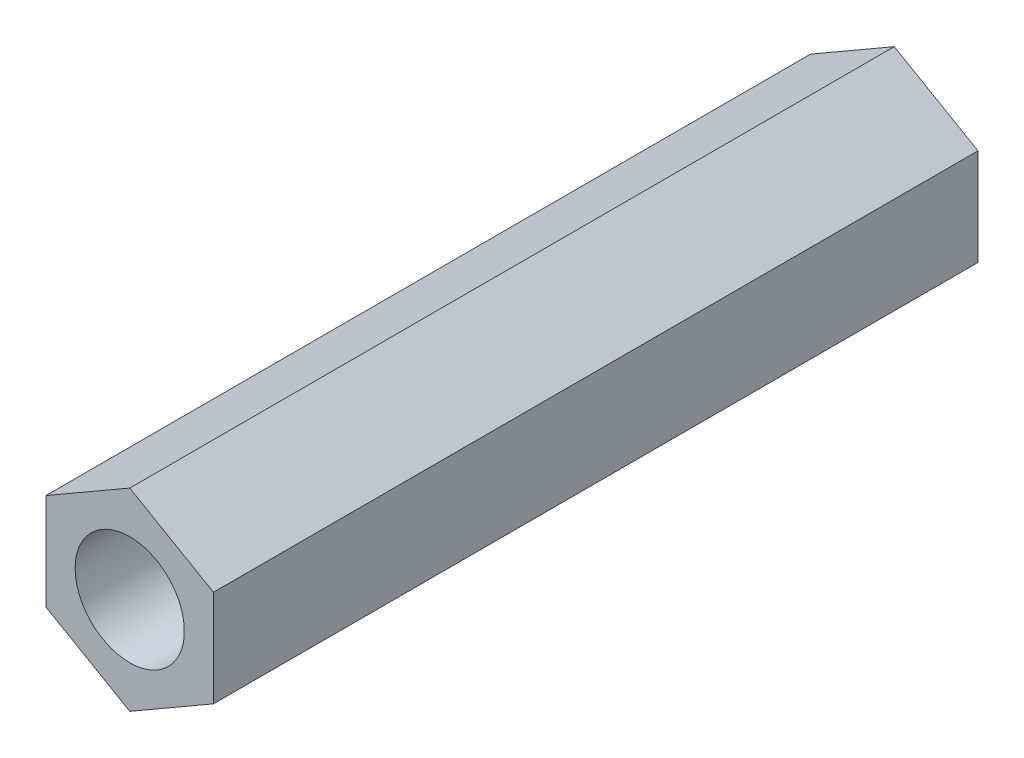
from build123d import *

# Parameters (mm, degrees)
SKETCH_1_R      = 1.5
EXTRUDE_1_DEPTH = 21


with BuildPart() as part:
    # 草图1 → 凸台-拉伸1 (new body)
    with BuildSketch(Plane.XY):
        Polygon((2.3, -1.327905619), (2.3, 1.327905619), (0, 2.655811238), (-2.3, 1.327905619), (-2.3, -1.327905619), (0, -2.655811238), align=None)
        with Locations(Location((0, 0, 0), (0, 0, 180))):
            Circle(SKETCH_1_R, mode=Mode.SUBTRACT)
    extrude(amount=EXTRUDE_1_DEPTH)


solid = part.part
